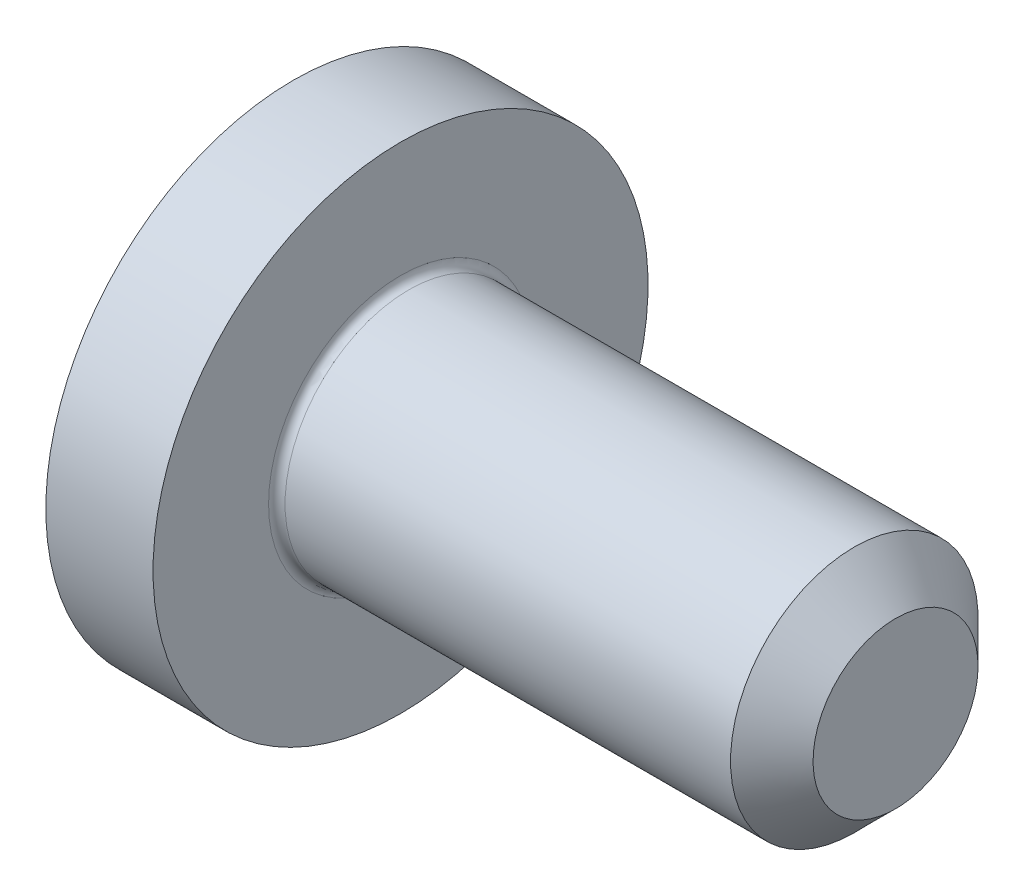
from build123d import *

# Parameters (mm, degrees)
CUT_EXTRUDE1_DEPTH = 2


with BuildPart() as part:
    # Sketch1 → Revolve1 (revolve)
    with BuildSketch(Plane.XY):
        with BuildLine():
            Line((-1.3, 0), (6, 0))
            Line((6, 0), (6, -1))
            Line((6, -1), (5.5, -1.5))
            Line((5.5, -1.5), (0.1, -1.5))
            ThreePointArc((0.1, -1.5), (0.029289322, -1.529289322), (0, -1.6))
            Line((0, -1.6), (0, -3))
            Line((0, -3), (-1.3, -3))
            Line((-1.3, -3), (-1.3, 0))
        make_face()
    revolve(axis=Axis((6, 0, 0), (-1, 0, 0)))

    # Sketch2 → Cut-Extrude1 (cut)
    with BuildSketch(Plane.ZY.offset(1.3)):
        Polygon((0, 0.866025404), (-0.75, 0.433012702), (-0.75, -0.433012702), (0, -0.866025404), (0.75, -0.433012702), (0.75, 0.433012702), align=None)
    extrude(amount=-CUT_EXTRUDE1_DEPTH, mode=Mode.SUBTRACT)


solid = part.part
